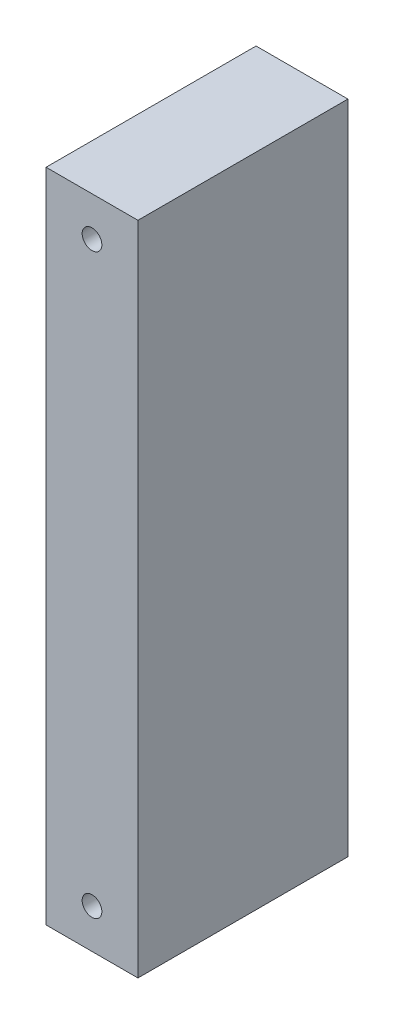
from build123d import *
from build123d.topology import SkipClean

# Parameters (mm, degrees)
SKETCH1_W           = 7
SKETCH1_H           = 50
SKETCH1_R           = 0.75
BOSS_EXTRUDE1_DEPTH = 14
BOSS_EXTRUDE2_START = 2
SKETCH3_W           = 7
SKETCH3_H           = 50
SKETCH3_R           = 0.75
BOSS_EXTRUDE2_DEPTH = 2


with BuildPart() as part:
    # Sketch1 → Boss-Extrude1 (new body)
    with BuildSketch(Plane.XY):
        Rectangle(SKETCH1_W, SKETCH1_H)
        with Locations((0, 22)):
            Circle(SKETCH1_R, mode=Mode.SUBTRACT)
        with Locations((0, -22)):
            Circle(SKETCH1_R, mode=Mode.SUBTRACT)
    extrude(amount=BOSS_EXTRUDE1_DEPTH)

    # Sketch3 → Boss-Extrude2 (add)
    with SkipClean():  # the faces are left unmerged after this step: merging them gives an invalid solid
        with BuildSketch(Plane(origin=(0, 0, 0), x_dir=(-1, 0, 0), z_dir=(0, 0, -1)).offset(BOSS_EXTRUDE2_START)):
            Rectangle(SKETCH3_W, SKETCH3_H)
            with Locations((0, 22)):
                Circle(SKETCH3_R, mode=Mode.SUBTRACT)
            with Locations((0, -22)):
                Circle(SKETCH3_R, mode=Mode.SUBTRACT)
        extrude(amount=-BOSS_EXTRUDE2_DEPTH)


solid = part.part
